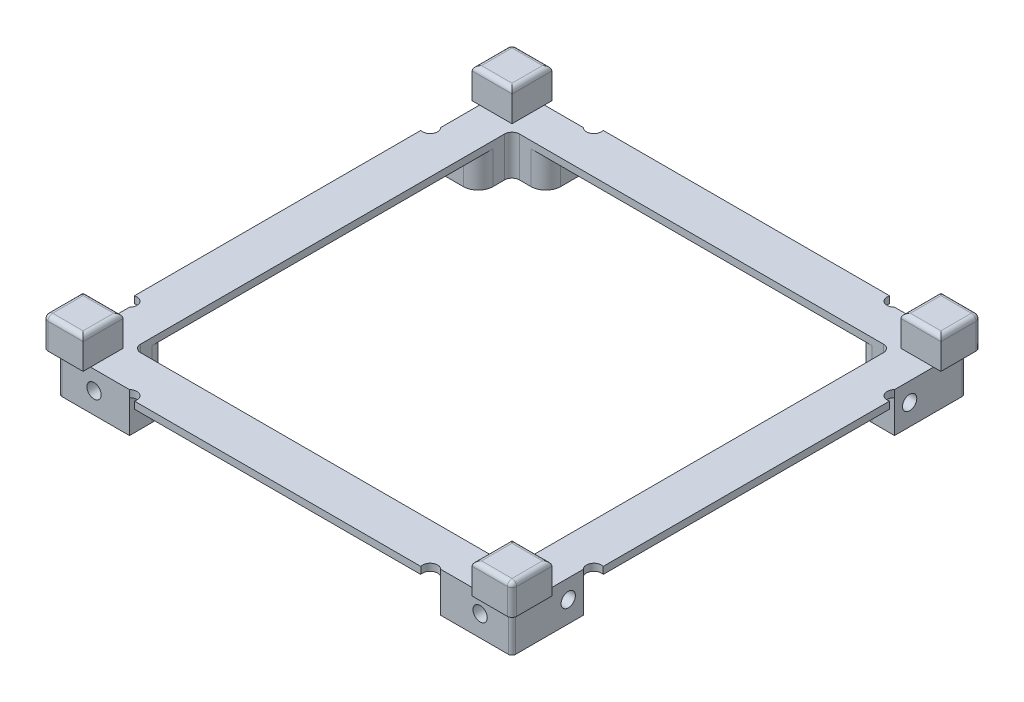
from build123d import *

# Parameters (mm, degrees)
SKETCH1_W                         = 100
SKETCH1_H                         = 100
BOSS_EXTRUDE1_DEPTH               = 8.5
CUT_EXTRUDE1_DEPTH                = 142.676568281
SKETCH3_W                         = 8.5
SKETCH3_H                         = 8.5
BOSS_EXTRUDE2_DEPTH               = 6.5
TAP_DRILL_FOR_4_HELICOIL5_D       = 3.048
TAP_DRILL_FOR_4_HELICOIL5_DEPTH   = 5.69
TAP_DRILL_FOR_4_HELICOIL5_TIP     = 0.915711583
TAP_DRILL_FOR_4_HELICOIL5_4_D     = 3.048
TAP_DRILL_FOR_4_HELICOIL5_4_DEPTH = 5.69
TAP_DRILL_FOR_4_HELICOIL5_4_TIP   = 0.915711583
CUT_EXTRUDE2_DEPTH                = 7
CUT_EXTRUDE3_DEPTH                = 142.647449677
FILLET1_R                         = 1
FILLET2_R                         = 3.175
FILLET3_R                         = 0.79
TAP_DRILL_FOR_4_HELICOIL5_5_D     = 3.048
TAP_DRILL_FOR_4_HELICOIL5_5_DEPTH = 5.69
TAP_DRILL_FOR_4_HELICOIL5_5_TIP   = 0.915711583


with BuildPart() as part:
    # Sketch1 → Boss-Extrude1 (new body)
    with BuildSketch(Plane(origin=(0, 0, 0), x_dir=(1, 0, 0), z_dir=(0, 1, 0))):
        with Locations((50, 50)):
            Rectangle(SKETCH1_W, SKETCH1_H)
    extrude(amount=BOSS_EXTRUDE1_DEPTH)

    # Sketch2 → Cut-Extrude1 (cut, through all)
    with BuildSketch(Plane(origin=(0, 8.5, 0), x_dir=(1, 0, 0), z_dir=(0, 1, 0))):
        with BuildLine():
            Line((19.05, 100), (0, 100))
            Line((0, 100), (0, 83.590412453))
            Line((0, 83.590412453), (0, 80.95))
            Line((0, 80.95), (0, 80.554651577))
            ThreePointArc((0, 80.554651577), (1.825498063, 81.254538032), (1.5875, 83.19506403))
            Line((1.5875, 83.19506403), (1.5875, 98.4125))
            Line((1.5875, 98.4125), (16.80493597, 98.4125))
            ThreePointArc((16.80493597, 98.4125), (18.745461968, 98.174501937), (19.445348423, 100))
            Line((19.445348423, 100), (19.05, 100))
        make_face()
        with BuildLine():
            Line((80.95, 100), (80.554651577, 100))
            ThreePointArc((80.554651577, 100), (81.254538032, 98.174501937), (83.19506403, 98.4125))
            Line((83.19506403, 98.4125), (98.4125, 98.4125))
            Line((98.4125, 98.4125), (98.4125, 83.19506403))
            ThreePointArc((98.4125, 83.19506403), (98.174501937, 81.254538032), (100, 80.554651577))
            Line((100, 80.554651577), (100, 80.95))
            Line((100, 80.95), (100, 83.590412453))
            Line((100, 83.590412453), (100, 100))
            Line((100, 100), (80.95, 100))
        make_face()
        with BuildLine():
            Line((1.5875, 1.5875), (16.80493597, 1.5875))
            ThreePointArc((16.80493597, 1.5875), (18.745461968, 1.825498063), (19.445348423, 0))
            Line((19.445348423, 0), (19.05, 0))
            Line((19.05, 0), (0, 0))
            Line((0, 0), (0, 19.05))
            Line((0, 19.05), (0, 19.445348423))
            ThreePointArc((0, 19.445348423), (1.825498063, 18.745461968), (1.5875, 16.80493597))
            Line((1.5875, 16.80493597), (1.5875, 1.5875))
        make_face()
        with BuildLine():
            Line((98.4125, 1.5875), (83.19506403, 1.5875))
            ThreePointArc((83.19506403, 1.5875), (81.254538032, 1.825498063), (80.554651577, 0))
            Line((80.554651577, 0), (80.95, 0))
            Line((80.95, 0), (100, 0))
            Line((100, 0), (100, 19.05))
            Line((100, 19.05), (100, 19.445348423))
            ThreePointArc((100, 19.445348423), (98.174501937, 18.745461968), (98.4125, 16.80493597))
            Line((98.4125, 16.80493597), (98.4125, 1.5875))
        make_face()
    extrude(amount=-CUT_EXTRUDE1_DEPTH, mode=Mode.SUBTRACT)

    # Sketch3 → Boss-Extrude2 (add)
    with BuildSketch(Plane(origin=(0, 8.5, 0), x_dir=(1, 0, 0), z_dir=(0, 1, 0))):
        with Locations((4.25, 4.25)):
            Rectangle(SKETCH3_W, SKETCH3_H)
        with Locations((95.75, 4.25)):
            Rectangle(SKETCH3_W, SKETCH3_H)
        with Locations((95.75, 95.75)):
            Rectangle(SKETCH3_W, SKETCH3_H)
        with Locations((4.25, 95.75)):
            Rectangle(SKETCH3_W, SKETCH3_H)
    extrude(amount=BOSS_EXTRUDE2_DEPTH)

    # Tap Drill for _4 Helicoil5
    with Locations(Plane(origin=(0, 0, 0), x_dir=(-1, 0, 0), z_dir=(0, -1, 0))):
        with Locations((-86.195, 7.1375), (-90.005, 92.8625), (-12.535, 7.1375), (-9.995, 92.8625)):
            Hole(TAP_DRILL_FOR_4_HELICOIL5_D / 2, depth=TAP_DRILL_FOR_4_HELICOIL5_DEPTH)
            with Locations((0, 0, -(TAP_DRILL_FOR_4_HELICOIL5_DEPTH + TAP_DRILL_FOR_4_HELICOIL5_TIP / 2))):  # 118° drill point
                Cone(0, TAP_DRILL_FOR_4_HELICOIL5_D / 2, TAP_DRILL_FOR_4_HELICOIL5_TIP, mode=Mode.SUBTRACT)

    # Sketch18 → Tap Drill for _4 Helicoil5 2 (revolve, cut)
    with BuildSketch(Plane(origin=(1.5875, 4.5, -86.4125), x_dir=(0, 0, 1), z_dir=(0, 1, 0))):
        Polygon((0, 0), (0, 6.605711583), (1.524, 5.69), (1.524, 0), align=None)
    tap_drill_for_4_helicoil5_2 = revolve(axis=Axis((-4.7625, 4.5, -86.4125), (1, 0, 0)), mode=Mode.SUBTRACT)

    # Mirror1: Tap Drill for _4 Helicoil5 2 across plane
    add(tap_drill_for_4_helicoil5_2.mirror(Plane(origin=(0, 0, -50), x_dir=(1, 0, 0), z_dir=(0, 0, -1))), mode=Mode.SUBTRACT)

    # Mirror2: Tap Drill for _4 Helicoil5 2 across plane
    add(tap_drill_for_4_helicoil5_2.mirror(Plane.ZY.offset(-50)), mode=Mode.SUBTRACT)

    # Mirror2 copy 1 sketch → Mirror2 copy 1 (revolve, cut)
    with BuildSketch(Plane(origin=(98.4125, 4.5, -13.5875), x_dir=(0, 0, -1), z_dir=(0, 1, 0))):
        Polygon((0, 0), (0, 6.605711583), (1.524, 5.69), (1.524, 0), align=None)
    revolve(axis=Axis((104.7625, 4.5, -13.5875), (-1, 0, 0)), mode=Mode.SUBTRACT)

    # Sketch21 → Tap Drill for _4 Helicoil5 3 (revolve, cut)
    with BuildSketch(Plane(origin=(13.5875, 4.5, -98.4125), x_dir=(0, 1, 0), z_dir=(1, 0, 0))):
        Polygon((0, 0), (0, 6.605711583), (1.524, 5.69), (1.524, 0), align=None)
    tap_drill_for_4_helicoil5_3 = revolve(axis=Axis((13.5875, 4.5, -104.7625), (0, 0, 1)), mode=Mode.SUBTRACT)

    # Mirror3: Tap Drill for _4 Helicoil5 3 across plane
    add(tap_drill_for_4_helicoil5_3.mirror(Plane.ZY.offset(-50)), mode=Mode.SUBTRACT)

    # Tap Drill for _4 Helicoil5 4
    with Locations(Plane.XY.offset(-1.5875)):
        with Locations((91.6125, 4.5)):
            Hole(TAP_DRILL_FOR_4_HELICOIL5_4_D / 2, depth=TAP_DRILL_FOR_4_HELICOIL5_4_DEPTH)
            with Locations((0, 0, -(TAP_DRILL_FOR_4_HELICOIL5_4_DEPTH + TAP_DRILL_FOR_4_HELICOIL5_4_TIP / 2))):  # 118° drill point
                Cone(0, TAP_DRILL_FOR_4_HELICOIL5_4_D / 2, TAP_DRILL_FOR_4_HELICOIL5_4_TIP, mode=Mode.SUBTRACT)

    # Sketch22 → Cut-Extrude2 (cut)
    with BuildSketch(Plane.XZ):
        with BuildLine():
            Line((83.19506403, -9.5875), (88.825, -9.5875))
            ThreePointArc((88.825, -9.5875), (89.947532015, -10.052467985), (90.4125, -11.175))
            Line((90.4125, -11.175), (90.4125, -16.80493597))
            Line((90.4125, -16.80493597), (98.4125, -16.80493597))
            Line((98.4125, -16.80493597), (100, -16.80493597))
            Line((100, -16.80493597), (100, -83.19506403))
            Line((100, -83.19506403), (98.4125, -83.19506403))
            Line((98.4125, -83.19506403), (90.4125, -83.19506403))
            Line((90.4125, -83.19506403), (90.4125, -88.825))
            ThreePointArc((90.4125, -88.825), (89.947532015, -89.947532015), (88.825, -90.4125))
            Line((88.825, -90.4125), (83.19506403, -90.4125))
            Line((83.19506403, -90.4125), (83.19506403, -98.4125))
            Line((83.19506403, -98.4125), (83.19506403, -100))
            Line((83.19506403, -100), (16.80493597, -100))
            Line((16.80493597, -100), (16.80493597, -98.4125))
            Line((16.80493597, -98.4125), (16.80493597, -90.4125))
            Line((16.80493597, -90.4125), (11.175, -90.4125))
            ThreePointArc((11.175, -90.4125), (10.052467985, -89.947532015), (9.5875, -88.825))
            Line((9.5875, -88.825), (9.5875, -83.19506403))
            Line((9.5875, -83.19506403), (1.5875, -83.19506403))
            Line((1.5875, -83.19506403), (0, -83.19506403))
            Line((0, -83.19506403), (0, -16.80493597))
            Line((0, -16.80493597), (1.5875, -16.80493597))
            Line((1.5875, -16.80493597), (9.5875, -16.80493597))
            Line((9.5875, -16.80493597), (9.5875, -11.175))
            ThreePointArc((9.5875, -11.175), (10.052467985, -10.052467985), (11.175, -9.5875))
            Line((11.175, -9.5875), (16.80493597, -9.5875))
            Line((16.80493597, -9.5875), (16.80493597, -1.5875))
            Line((16.80493597, -1.5875), (16.80493597, 0))
            Line((16.80493597, 0), (83.19506403, 0))
            Line((83.19506403, 0), (83.19506403, -1.5875))
            Line((83.19506403, -1.5875), (83.19506403, -9.5875))
        make_face()
    extrude(amount=-CUT_EXTRUDE2_DEPTH, mode=Mode.SUBTRACT)

    # Sketch23 → Cut-Extrude3 (cut, through all)
    with BuildSketch(Plane.XZ.offset(-7)):
        with BuildLine():
            Line((11.175, -90.4125), (88.825, -90.4125))
            ThreePointArc((88.825, -90.4125), (89.947532015, -89.947532015), (90.4125, -88.825))
            Line((90.4125, -88.825), (90.4125, -11.175))
            ThreePointArc((90.4125, -11.175), (89.947532015, -10.052467985), (88.825, -9.5875))
            Line((88.825, -9.5875), (11.175, -9.5875))
            ThreePointArc((11.175, -9.5875), (10.052467985, -10.052467985), (9.5875, -11.175))
            Line((9.5875, -11.175), (9.5875, -88.825))
            ThreePointArc((9.5875, -88.825), (10.052467985, -89.947532015), (11.175, -90.4125))
        make_face()
    extrude(amount=-CUT_EXTRUDE3_DEPTH, mode=Mode.SUBTRACT)

    # Fillet1
    fillet1_edges = [part.edges().sort_by_distance(p)[0] for p in [
        (0, 11.75, 0),
        (0, 15, -4.25),
        (4.25, 15, 0),
        (8.5, 15, -4.25),
        (4.25, 15, -8.5),
        (100, 11.75, 0),
        (100, 15, -4.25),
        (95.75, 15, -8.5),
        (91.5, 15, -4.25),
        (95.75, 15, 0),
        (100, 11.75, -100),
        (95.75, 15, -100),
        (91.5, 15, -95.75),
        (95.75, 15, -91.5),
        (100, 15, -95.75),
        (0, 11.75, -100),
        (0, 15, -95.75),
        (4.25, 15, -91.5),
        (8.5, 15, -95.75),
        (4.25, 15, -100),
    ]]
    fillet(fillet1_edges, radius=FILLET1_R)

    # Fillet2
    fillet2_edges = [part.edges().sort_by_distance(p)[0] for p in [
        (9.5875, 3.5, -83.19506403),
        (90.4125, 3.5, -16.80493597),
        (90.4125, 3.5, -83.19506403),
        (83.19506403, 3.5, -90.4125),
        (16.80493597, 3.5, -90.4125),
        (9.5875, 3.5, -16.80493597),
        (16.80493597, 3.5, -9.5875),
        (83.19506403, 3.5, -9.5875),
    ]]
    fillet(fillet2_edges, radius=FILLET2_R)

    # Fillet3
    fillet3_edges = [part.edges().sort_by_distance(p)[0] for p in [
        (98.4125, 4.25, -98.4125),
        (1.5875, 4.25, -1.5875),
        (98.4125, 4.25, -1.5875),
        (1.5875, 4.25, -98.4125),
    ]]
    fillet(fillet3_edges, radius=FILLET3_R)

    # Tap Drill for _4 Helicoil5 5
    with Locations(Plane.XY.offset(-1.5875)):
        with Locations((9.2475, 4.5)):
            Hole(TAP_DRILL_FOR_4_HELICOIL5_5_D / 2, depth=TAP_DRILL_FOR_4_HELICOIL5_5_DEPTH)
            with Locations((0, 0, -(TAP_DRILL_FOR_4_HELICOIL5_5_DEPTH + TAP_DRILL_FOR_4_HELICOIL5_5_TIP / 2))):  # 118° drill point
                Cone(0, TAP_DRILL_FOR_4_HELICOIL5_5_D / 2, TAP_DRILL_FOR_4_HELICOIL5_5_TIP, mode=Mode.SUBTRACT)


solid = part.part
